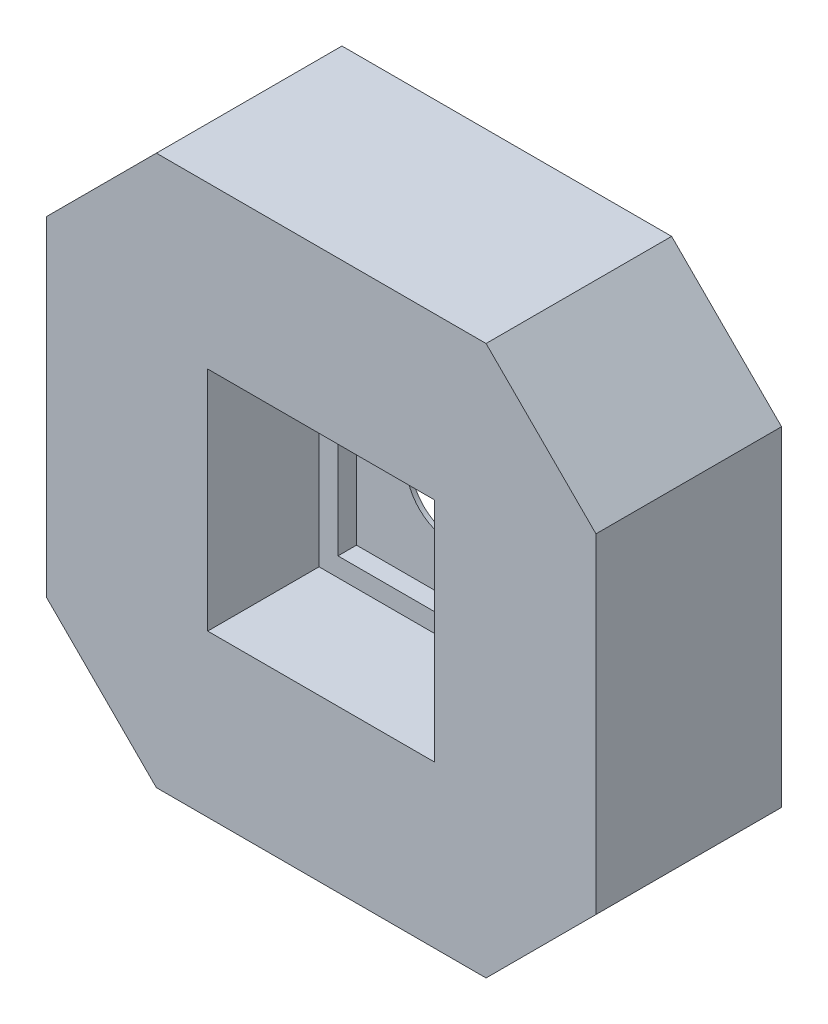
from build123d import *

# Parameters (mm, degrees)
EXTRUDE_1_DEPTH                 = 206
SKETCH_2_W                      = 252
SKETCH_2_H                      = 252
CUT_EXTRUDE_1_DEPTH             = 123.6
SKETCH_3_W                      = 210
SKETCH_3_H                      = 210
CUT_EXTRUDE_2_DEPTH             = 144.2
SHELL_1_T                       = -5
SKETCH_4_R                      = 50
CUT_EXTRUDE_3_DEPTH             = 455.80065963
EXTRUDE_2_DEPTH                 = 10
PATTERN_CIRCULAR_1_COUNT        = 4
PATTERN_CIRCULAR_1_COPY_1_DEPTH = 10
PATTERN_CIRCULAR_1_COPY_2_DEPTH = 10
PATTERN_CIRCULAR_1_COPY_3_DEPTH = 10


with BuildPart() as part:
    # 草图1 → 凸台-拉伸1 (new body)
    with BuildSketch(Plane.XY):
        Polygon((-305, 183), (-183, 305), (183, 305), (305, 183), (305, -183), (183, -305), (-183, -305), (-305, -183), align=None)
    extrude(amount=EXTRUDE_1_DEPTH)

    # 草图2 → 切除-拉伸1 (cut)
    with BuildSketch(Plane.XY.offset(206)):
        Rectangle(SKETCH_2_W, SKETCH_2_H)
    extrude(amount=-CUT_EXTRUDE_1_DEPTH, mode=Mode.SUBTRACT)

    # 草图3 → 切除-拉伸2 (cut)
    with BuildSketch(Plane.XY.offset(206)):
        Rectangle(SKETCH_3_W, SKETCH_3_H)
    extrude(amount=-CUT_EXTRUDE_2_DEPTH, mode=Mode.SUBTRACT)

    # 抽壳1
    shell_1_openings = [part.faces().sort_by_distance(p)[0] for p in [
        (0, 0, 0),
    ]]
    offset(amount=SHELL_1_T, openings=shell_1_openings, kind=Kind.INTERSECTION)

    # 草图4 → 切除-拉伸3 (cut, through all)
    with BuildSketch(Plane.XY.offset(61.8)):
        Circle(SKETCH_4_R)
    extrude(amount=-CUT_EXTRUDE_3_DEPTH, mode=Mode.SUBTRACT)

    # 草图5 → 凸台-拉伸2 (add)
    with BuildSketch(Plane(origin=(0, 91.5, 0), x_dir=(1, 0, 0), z_dir=(0, 1, 0))):
        Polygon((-131, -82.4), (-300, -112.19925974), (-300, -200.864779471), (-131, -200.864779471), align=None)
    extrude_2 = extrude(amount=-EXTRUDE_2_DEPTH)

    # 镜向1: 凸台-拉伸2 across plane
    add(extrude_2.mirror(Plane.ZX))

    # 阵列(圆周)1: 凸台-拉伸2 ×4 about axis
    pattern_circular_1_axis = Axis((0, 0, 0), (0, 0, 1))
    for i in range(1, PATTERN_CIRCULAR_1_COUNT):
        add(extrude_2.rotate(pattern_circular_1_axis, i * 360 / PATTERN_CIRCULAR_1_COUNT))

    # 阵列(圆周)1 copy 1 sketch → 阵列(圆周)1 copy 1 (add)
    with BuildSketch(Plane.YZ.offset(91.5)):
        Polygon((-131, 82.4), (-300, 112.19925974), (-300, 200.864779471), (-131, 200.864779471), align=None)
    extrude(amount=-PATTERN_CIRCULAR_1_COPY_1_DEPTH)

    # 阵列(圆周)1 copy 2 sketch → 阵列(圆周)1 copy 2 (add)
    with BuildSketch(Plane(origin=(0, 91.5, 0), x_dir=(-1, 0, 0), z_dir=(0, 1, 0))):
        Polygon((-131, 82.4), (-300, 112.19925974), (-300, 200.864779471), (-131, 200.864779471), align=None)
    extrude(amount=-PATTERN_CIRCULAR_1_COPY_2_DEPTH)

    # 阵列(圆周)1 copy 3 sketch → 阵列(圆周)1 copy 3 (add)
    with BuildSketch(Plane(origin=(-91.5, 0, 0), x_dir=(0, -1, 0), z_dir=(-1, 0, 0))):
        Polygon((-131, 82.4), (-300, 112.19925974), (-300, 200.864779471), (-131, 200.864779471), align=None)
    extrude(amount=-PATTERN_CIRCULAR_1_COPY_3_DEPTH)


solid = part.part
